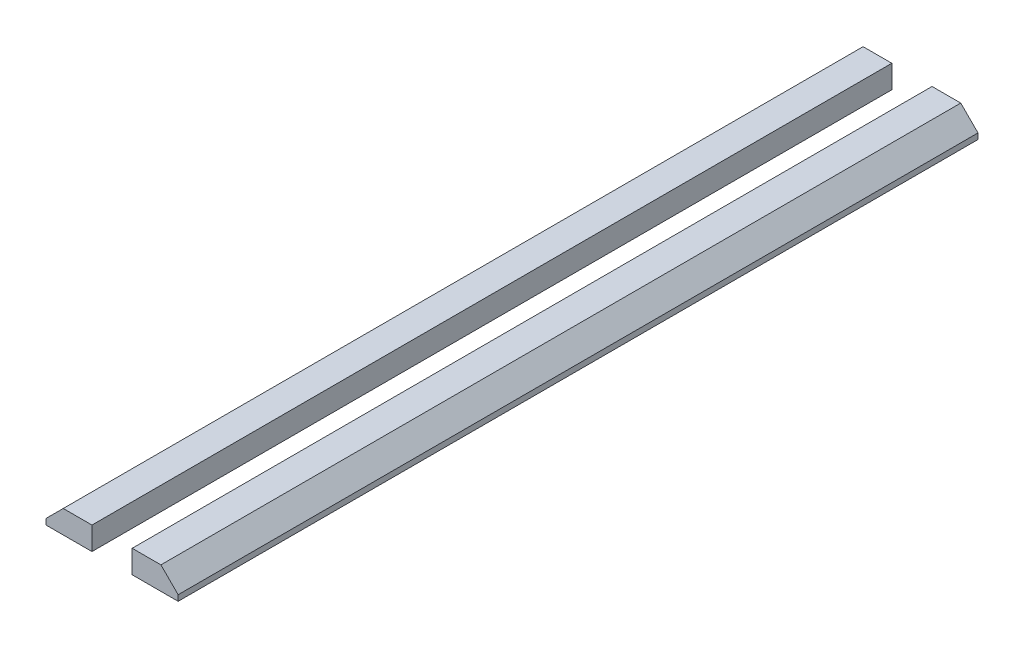
from build123d import *

# Parameters (mm, degrees)
BOSS_EXTRUDE1_DEPTH   = 139.217420787
BOSS_EXTRUDE1_2_DEPTH = 139.217420787


with BuildPart() as part:
    # Sketch1 → Boss-Extrude1 (new body)
    with BuildSketch(Plane.XY):
        Polygon((-3.5, 0), (-3.5, -4), (-11.5, -4), (-11.5, -3), (-8.5, 0), align=None)
    extrude(amount=-BOSS_EXTRUDE1_DEPTH)


with BuildPart() as body_2:
    # Sketch1 → Boss-Extrude1 2 (new body)
    with BuildSketch(Plane.XY):
        Polygon((11.5, -4), (11.5, -3), (8.5, 0), (3.5, 0), (3.5, -4), align=None)
    extrude(amount=-BOSS_EXTRUDE1_2_DEPTH)


solid = Compound([part.part, body_2.part])
